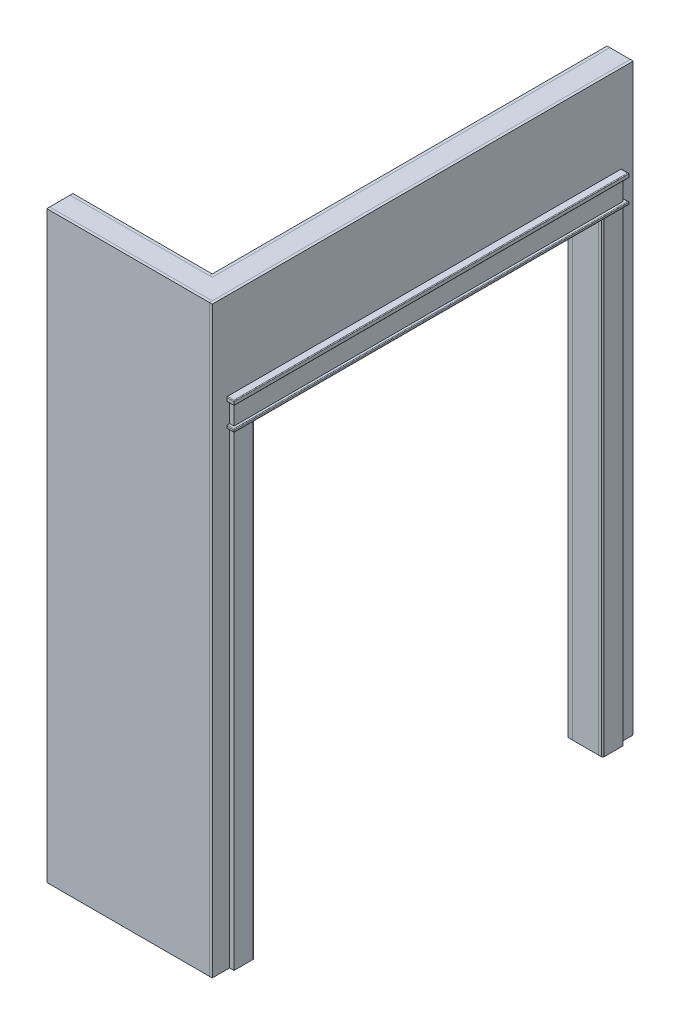
from build123d import *

# Parameters (mm, degrees)
SKETCH2_W                          = 622.3
SKETCH2_H                          = 88.9
SOLE_PLATE_1_DEPTH                 = 38.1
SKETCH3_W                          = 88.9
SKETCH3_H                          = 133.35
SOLE_PLATE_2_DEPTH                 = 38.1
SOLE_PLATE_2_2_DEPTH               = 38.1
SKETCH5_W                          = 88.9
SKETCH5_H                          = 38.1
FRAMING_STUDS_DEPTH                = 2438.4
SKETCH5_W_2                        = 38.1
SKETCH5_H_2                        = 88.9
FRAMING_STUDS_2_DEPTH              = 2438.4
FRAMING_STUDS_3_DEPTH              = 2438.4
FRAMING_STUDS_4_DEPTH              = 2438.4
FRAMING_STUDS_5_DEPTH              = 2438.4
FRAMING_STUDS_6_DEPTH              = 2438.4
SKETCH6_W                          = 88.9
SKETCH6_H                          = 38.1
JACK_STUDS_DEPTH                   = 2030.4125
JACK_STUDS_2_DEPTH                 = 2030.4125
SKETCH7_W                          = 88.9
SKETCH7_H                          = 1638.3
HEADER_DEPTH                       = 38.1
SKETCH8_W                          = 88.9
SKETCH8_H                          = 38.1
CRIPPLE_STUDS_DEPTH                = 369.8875
CRIPPLE_STUDS_2_DEPTH              = 369.8875
CRIPPLE_STUDS_3_DEPTH              = 369.8875
CRIPPLE_STUDS_4_DEPTH              = 369.8875
CRIPPLE_STUDS_5_DEPTH              = 369.8875
TOP_PLATE_1_DEPTH                  = 38.1
SKETCH10_W                         = 622.3
SKETCH10_H                         = 2552.7
INSIDE_SIDE_WALL_DRY_WALL_DEPTH    = 12.7
INSIDE_MAIN_WALL_DRY_WALL_DEPTH    = 12.7
SKETCH12_W                         = 711.2
SKETCH12_H                         = 2552.7
OUTSIDE_SIDE_WALL_DRY_WALL_DEPTH   = 12.7
OUTSIDE_MAIN_WALL_DRY_WALL_DEPTH   = 12.7
TOP_PLATE_2_DEPTH                  = 38.1
SKETCH14_W                         = 88.9
SKETCH14_H                         = 2049.4625
CASING_FLAT_DEPTH                  = 19.05
CASING_FLAT_2_DEPTH                = 19.05
SKETCH14_W_2                       = 1701.8
SKETCH14_H_2                       = 88.9
CASING_FLAT_3_DEPTH                = 19.05
CASING_FILLET_DEPTH                = 31.75
FILLET1_R                          = 3.175
FILLET2_R                          = 6.35
SKETCH17_W                         = 114.3
SKETCH17_H                         = 1562.1
TRIM_DOOR_TOP_DEPTH                = 19.05
SKETCH18_W                         = 114.3
SKETCH18_H                         = 2049.4625
TRIM_DOOR_RIGHT_DEPTH              = 19.05
SKETCH19_W                         = 114.3
SKETCH19_H                         = 2049.4625
TRIM_DOOR_LEFT_DEPTH               = 19.05
SKETCH20_W                         = 50.904154608
SKETCH20_H                         = 2049.782283847
CASING_DOOR_INTERIOR_SIDES_DEPTH   = 19.05
SKETCH20_W_2                       = 88.9
CASING_DOOR_INTERIOR_SIDES_2_DEPTH = 19.05
CASING_DOOR_INTERIOR_TOP_DEPTH     = 19.05
SKETCH23_W                         = 38.1
SKETCH23_H                         = 88.9
BOSS_EXTRUDE1_DEPTH                = 2438.4


with BuildPart() as part:
    # Sketch2 → Sole Plate 1 (new body)
    with BuildSketch(Plane(origin=(0, 0, 0), x_dir=(1, 0, 0), z_dir=(0, 1, 0))):
        with Locations((311.15, 1695.45)):
            Rectangle(SKETCH2_W, SKETCH2_H)
    extrude(amount=SOLE_PLATE_1_DEPTH)


with BuildPart() as body_2:
    # Sketch3 → Sole Plate 2 (new body)
    with BuildSketch(Plane(origin=(0, 0, 0), x_dir=(1, 0, 0), z_dir=(0, 1, 0))):
        with Locations((666.75, 1717.675)):
            Rectangle(SKETCH3_W, SKETCH3_H)
    extrude(amount=SOLE_PLATE_2_DEPTH)


with BuildPart() as body_3:
    # Sketch3 → Sole Plate 2 2 (new body)
    with BuildSketch(Plane(origin=(0, 0, 0), x_dir=(1, 0, 0), z_dir=(0, 1, 0))):
        with Locations((666.75, 3413.125)):
            Rectangle(SKETCH3_W, SKETCH3_H)
    extrude(amount=SOLE_PLATE_2_2_DEPTH)


with BuildPart() as body_4:
    # Sketch5 → Framing Studs (new body)
    with BuildSketch(Plane(origin=(0, 38.1, 0), x_dir=(1, 0, 0), z_dir=(0, 1, 0))):
        with Locations((666.75, 1670.05)):
            Rectangle(SKETCH5_W, SKETCH5_H)
    extrude(amount=FRAMING_STUDS_DEPTH)


with BuildPart() as body_5:
    # Sketch5 → Framing Studs 2 (new body)
    with BuildSketch(Plane(origin=(0, 38.1, 0), x_dir=(1, 0, 0), z_dir=(0, 1, 0))):
        with Locations((19.05, 1695.45)):
            Rectangle(SKETCH5_W_2, SKETCH5_H_2)
    extrude(amount=FRAMING_STUDS_2_DEPTH)


with BuildPart() as body_6:
    # Sketch5 → Framing Studs 3 (new body)
    with BuildSketch(Plane(origin=(0, 38.1, 0), x_dir=(1, 0, 0), z_dir=(0, 1, 0))):
        with Locations((425.45, 1695.45)):
            Rectangle(SKETCH5_W_2, SKETCH5_H_2)
    extrude(amount=FRAMING_STUDS_3_DEPTH)


with BuildPart() as body_7:
    # Sketch5 → Framing Studs 4 (new body)
    with BuildSketch(Plane(origin=(0, 38.1, 0), x_dir=(1, 0, 0), z_dir=(0, 1, 0))):
        with Locations((666.75, 3460.75)):
            Rectangle(SKETCH5_W, SKETCH5_H)
    extrude(amount=FRAMING_STUDS_4_DEPTH)


with BuildPart() as body_8:
    # Sketch5 → Framing Studs 5 (new body)
    with BuildSketch(Plane(origin=(0, 38.1, 0), x_dir=(1, 0, 0), z_dir=(0, 1, 0))):
        with Locations((666.75, 1727.2)):
            Rectangle(SKETCH5_W, SKETCH5_H)
    extrude(amount=FRAMING_STUDS_5_DEPTH)


with BuildPart() as body_9:
    # Sketch5 → Framing Studs 6 (new body)
    with BuildSketch(Plane(origin=(0, 38.1, 0), x_dir=(1, 0, 0), z_dir=(0, 1, 0))):
        with Locations((666.75, 3403.6)):
            Rectangle(SKETCH5_W, SKETCH5_H)
    extrude(amount=FRAMING_STUDS_6_DEPTH)


with BuildPart() as body_10:
    # Sketch6 → Jack Studs (new body)
    with BuildSketch(Plane(origin=(0, 38.1, 0), x_dir=(1, 0, 0), z_dir=(0, 1, 0))):
        with Locations((666.75, 3365.5)):
            Rectangle(SKETCH6_W, SKETCH6_H)
    extrude(amount=JACK_STUDS_DEPTH)


with BuildPart() as body_11:
    # Sketch6 → Jack Studs 2 (new body)
    with BuildSketch(Plane(origin=(0, 38.1, 0), x_dir=(1, 0, 0), z_dir=(0, 1, 0))):
        with Locations((666.75, 1765.3)):
            Rectangle(SKETCH6_W, SKETCH6_H)
    extrude(amount=JACK_STUDS_2_DEPTH)


with BuildPart() as body_12:
    # Sketch7 → Header (new body)
    with BuildSketch(Plane(origin=(0, 2068.5125, 0), x_dir=(1, 0, 0), z_dir=(0, 1, 0))):
        with Locations((666.75, 2565.4)):
            Rectangle(SKETCH7_W, SKETCH7_H)
    extrude(amount=HEADER_DEPTH)


with BuildPart() as body_13:
    # Sketch8 → Cripple Studs (new body)
    with BuildSketch(Plane(origin=(0, 2106.6125, 0), x_dir=(1, 0, 0), z_dir=(0, 1, 0))):
        with Locations((666.75, 1765.3)):
            Rectangle(SKETCH8_W, SKETCH8_H)
    extrude(amount=CRIPPLE_STUDS_DEPTH)


with BuildPart() as body_14:
    # Sketch8 → Cripple Studs 2 (new body)
    with BuildSketch(Plane(origin=(0, 2106.6125, 0), x_dir=(1, 0, 0), z_dir=(0, 1, 0))):
        with Locations((666.75, 2171.7)):
            Rectangle(SKETCH8_W, SKETCH8_H)
    extrude(amount=CRIPPLE_STUDS_2_DEPTH)


with BuildPart() as body_15:
    # Sketch8 → Cripple Studs 3 (new body)
    with BuildSketch(Plane(origin=(0, 2106.6125, 0), x_dir=(1, 0, 0), z_dir=(0, 1, 0))):
        with Locations((666.75, 3365.5)):
            Rectangle(SKETCH8_W, SKETCH8_H)
    extrude(amount=CRIPPLE_STUDS_3_DEPTH)


with BuildPart() as body_16:
    # Sketch8 → Cripple Studs 4 (new body)
    with BuildSketch(Plane(origin=(0, 2106.6125, 0), x_dir=(1, 0, 0), z_dir=(0, 1, 0))):
        with Locations((666.75, 2578.1)):
            Rectangle(SKETCH8_W, SKETCH8_H)
    extrude(amount=CRIPPLE_STUDS_4_DEPTH)


with BuildPart() as body_17:
    # Sketch8 → Cripple Studs 5 (new body)
    with BuildSketch(Plane(origin=(0, 2106.6125, 0), x_dir=(1, 0, 0), z_dir=(0, 1, 0))):
        with Locations((666.75, 2984.5)):
            Rectangle(SKETCH8_W, SKETCH8_H)
    extrude(amount=CRIPPLE_STUDS_5_DEPTH)


with BuildPart() as body_18:
    # Sketch9 → Top Plate 1 (new body)
    with BuildSketch(Plane(origin=(0, 2476.5, 0), x_dir=(1, 0, 0), z_dir=(0, 1, 0))):
        Polygon((0, 1651), (711.2, 1651), (711.2, 3479.8), (622.3, 3479.8), (622.3, 1739.9), (0, 1739.9), align=None)
    extrude(amount=TOP_PLATE_1_DEPTH)


with BuildPart() as body_19:
    # Sketch10 → Inside Side Wall Dry Wall (new body)
    with BuildSketch(Plane(origin=(0, 0, -1739.9), x_dir=(-1, 0, 0), z_dir=(0, 0, -1))):
        with Locations((-311.15, 1276.35)):
            Rectangle(SKETCH10_W, SKETCH10_H)
    extrude(amount=INSIDE_SIDE_WALL_DRY_WALL_DEPTH)


with BuildPart() as body_20:
    # Sketch11 → Inside Main Wall Dry Wall (new body)
    with BuildSketch(Plane.ZY.offset(-622.300000001)):
        Polygon((-1739.9, 0), (-1739.9, 2552.7), (-3479.8, 2552.7), (-3479.8, 0), (-3346.45, 0), (-3346.45, 2068.5125), (-1784.35, 2068.5125), (-1784.35, 0), align=None)
    extrude(amount=INSIDE_MAIN_WALL_DRY_WALL_DEPTH)


with BuildPart() as body_21:
    # Sketch12 → Outside Side Wall Dry Wall (new body)
    with BuildSketch(Plane.XY.offset(-1651)):
        with Locations((355.6, 1276.35)):
            Rectangle(SKETCH12_W, SKETCH12_H)
    extrude(amount=OUTSIDE_SIDE_WALL_DRY_WALL_DEPTH)


with BuildPart() as body_22:
    # Sketch13 → Outside Main Wall Dry Wall (new body)
    with BuildSketch(Plane(origin=(711.2, 0, 0), x_dir=(0, 0, -1), z_dir=(1, 0, 0))):
        Polygon((3479.8, 0), (3346.45, 0), (3346.45, 2068.5125), (1784.35, 2068.5125), (1784.35, 0), (1638.3, 0), (1638.3, 2552.7), (3479.8, 2552.7), align=None)
    extrude(amount=OUTSIDE_MAIN_WALL_DRY_WALL_DEPTH)



with BuildPart() as body_23:
    # Sketch21 → Top Plate 2 (new body)
    with BuildSketch(Plane(origin=(0, 2514.6, 0), x_dir=(1, 0, 0), z_dir=(0, 1, 0))):
        Polygon((622.3, 3479.8), (622.3, 1739.9), (0, 1739.9), (0, 1651), (711.2, 1651), (711.2, 3479.8), align=None)
    extrude(amount=TOP_PLATE_2_DEPTH)


with BuildPart() as body_24:
    # Sketch14 → Casing Flat (new body)
    with BuildSketch(Plane(origin=(723.9, 0, 0), x_dir=(0, 0, -1), z_dir=(1, 0, 0))):
        with Locations((1758.95, 1024.73125)):
            Rectangle(SKETCH14_W, SKETCH14_H)
    extrude(amount=CASING_FLAT_DEPTH)


with BuildPart() as body_25:
    # Sketch14 → Casing Flat 2 (new body)
    with BuildSketch(Plane(origin=(723.9, 0, 0), x_dir=(0, 0, -1), z_dir=(1, 0, 0))):
        with Locations((3371.85, 1024.73125)):
            Rectangle(SKETCH14_W, SKETCH14_H)
    extrude(amount=CASING_FLAT_2_DEPTH)


with BuildPart() as body_26:
    # Sketch14 → Casing Flat 3 (new body)
    with BuildSketch(Plane(origin=(723.9, 0, 0), x_dir=(0, 0, -1), z_dir=(1, 0, 0))):
        with Locations((2565.4, 2106.6125)):
            Rectangle(SKETCH14_W_2, SKETCH14_H_2)
    extrude(amount=CASING_FLAT_3_DEPTH)


with BuildPart() as body_22_1:
    add(body_22.part)

    add(body_24.part)  # Casing Fillet merges body 24

    add(body_25.part)  # Casing Fillet merges body 25

    add(body_26.part)  # Casing Fillet merges body 26
    # Sketch14<3> → Casing Fillet (add)
    with BuildSketch(Plane(origin=(723.9, 0, 0), x_dir=(0, 0, -1), z_dir=(1, 0, 0))):
        Polygon((1701.8, 2151.0625), (1714.5, 2151.0625), (3416.3, 2151.0625), (3429, 2151.0625), (3429, 2170.1125), (1701.8, 2170.1125), align=None)
        Polygon((1784.35, 2049.4625), (1803.4, 2049.4625), (3327.4, 2049.4625), (3346.45, 2049.4625), (3346.45, 2062.1625), (1784.35, 2062.1625), align=None)
        Polygon((1714.5, 2049.4625), (1784.35, 2049.4625), (1784.35, 2062.1625), (1714.5, 2062.1625), (1701.8, 2062.1625), (1701.8, 2049.4625), align=None)
        Polygon((3346.45, 2062.1625), (3346.45, 2049.4625), (3416.3, 2049.4625), (3429, 2049.4625), (3429, 2062.1625), (3416.3, 2062.1625), align=None)
    extrude(amount=CASING_FILLET_DEPTH)

    # Fillet1
    fillet1_edges = [body_22_1.edges().sort_by_distance(p)[0] for p in [
        (739.775, 2151.0625, -3429),
        (755.65, 2170.1125, -2565.4),
        (739.775, 2170.1125, -3429),
        (739.775, 2170.1125, -1701.8),
        (739.775, 2151.0625, -1701.8),
        (755.65, 2151.0625, -2565.4),
        (755.65, 2062.1625, -2565.4),
        (739.775, 2062.1625, -3429),
        (755.65, 2049.4625, -2565.4),
        (739.775, 2049.4625, -1701.8),
        (739.775, 2049.4625, -3429),
        (739.775, 2062.1625, -1701.8),
    ]]
    fillet(fillet1_edges, radius=FILLET1_R)

    # Fillet2
    fillet2_edges = [body_22_1.edges().sort_by_distance(p)[0] for p in [
        (742.95, 1024.73125, -1803.4),
        (742.95, 1024.73125, -3327.4),
    ]]
    fillet(fillet2_edges, radius=FILLET2_R)


with BuildPart() as body_24_2:
    # Sketch17 → Trim Door Top (new body)
    with BuildSketch(Plane(origin=(0, 2068.5125, 0), x_dir=(-1, 0, 0), z_dir=(0, -1, 0))):
        with Locations((-666.75, 2565.4)):
            Rectangle(SKETCH17_W, SKETCH17_H)
    extrude(amount=TRIM_DOOR_TOP_DEPTH)


with BuildPart() as body_25_2:
    # Sketch18 → Trim Door Right (new body)
    with BuildSketch(Plane(origin=(0, 0, -3346.45), x_dir=(-1, 0, 0), z_dir=(0, 0, -1))):
        with Locations((-666.75, 1024.73125)):
            Rectangle(SKETCH18_W, SKETCH18_H)
    extrude(amount=-TRIM_DOOR_RIGHT_DEPTH)


with BuildPart() as body_26_2:
    # Sketch19 → Trim Door Left (new body)
    with BuildSketch(Plane(origin=(0, 0, -1784.35), x_dir=(-1, 0, 0), z_dir=(0, 0, -1))):
        with Locations((-666.75, 1024.73125)):
            Rectangle(SKETCH19_W, SKETCH19_H)
    extrude(amount=TRIM_DOOR_LEFT_DEPTH)


with BuildPart() as body_27:
    # Sketch20 → Casing Door interior Sides (new body)
    with BuildSketch(Plane.ZY.offset(-609.600000001)):
        with Locations((-1777.947922696, 1024.891141924)):
            Rectangle(SKETCH20_W, SKETCH20_H)
    extrude(amount=CASING_DOOR_INTERIOR_SIDES_DEPTH)


with BuildPart() as body_28:
    # Sketch20 → Casing Door interior Sides 2 (new body)
    with BuildSketch(Plane.ZY.offset(-609.600000001)):
        with Locations((-3371.85, 1024.891141924)):
            Rectangle(SKETCH20_W_2, SKETCH20_H)
    extrude(amount=CASING_DOOR_INTERIOR_SIDES_2_DEPTH)


with BuildPart() as body_29:
    # Sketch20<4> → Casing Door Interior Top (new body)
    with BuildSketch(Plane.ZY.offset(-609.600000001)):
        Polygon((-1784.35, 2068.5125), (-1784.35, 2049.782283847), (-1752.495845392, 2049.782283847), (-1752.495845392, 2138.682283847), (-3416.3, 2138.682283847), (-3416.3, 2049.782283847), (-3346.45, 2049.782283847), (-3346.45, 2068.5125), align=None)
        Polygon((-3327.4, 2049.782283847), (-1803.4, 2049.782283847), (-1784.35, 2049.782283847), (-1784.35, 2068.5125), (-3346.45, 2068.5125), (-3346.45, 2049.782283847), align=None)
    extrude(amount=CASING_DOOR_INTERIOR_TOP_DEPTH)


with BuildPart() as body_30:
    # Sketch23 → Boss-Extrude1 (new body)
    with BuildSketch(Plane(origin=(0, 38.1, 0), x_dir=(1, 0, 0), z_dir=(0, 1, 0))):
        with Locations((603.25, 1695.45)):
            Rectangle(SKETCH23_W, SKETCH23_H)
    extrude(amount=BOSS_EXTRUDE1_DEPTH)


solid = Compound([part.part, body_2.part, body_3.part, body_4.part, body_5.part, body_6.part, body_7.part, body_8.part, body_9.part, body_10.part, body_11.part, body_12.part, body_13.part, body_14.part, body_15.part, body_16.part, body_17.part, body_18.part, body_19.part, body_20.part, body_21.part, body_23.part, body_22_1.part, body_24_2.part, body_25_2.part, body_26_2.part, body_27.part, body_28.part, body_29.part, body_30.part])
